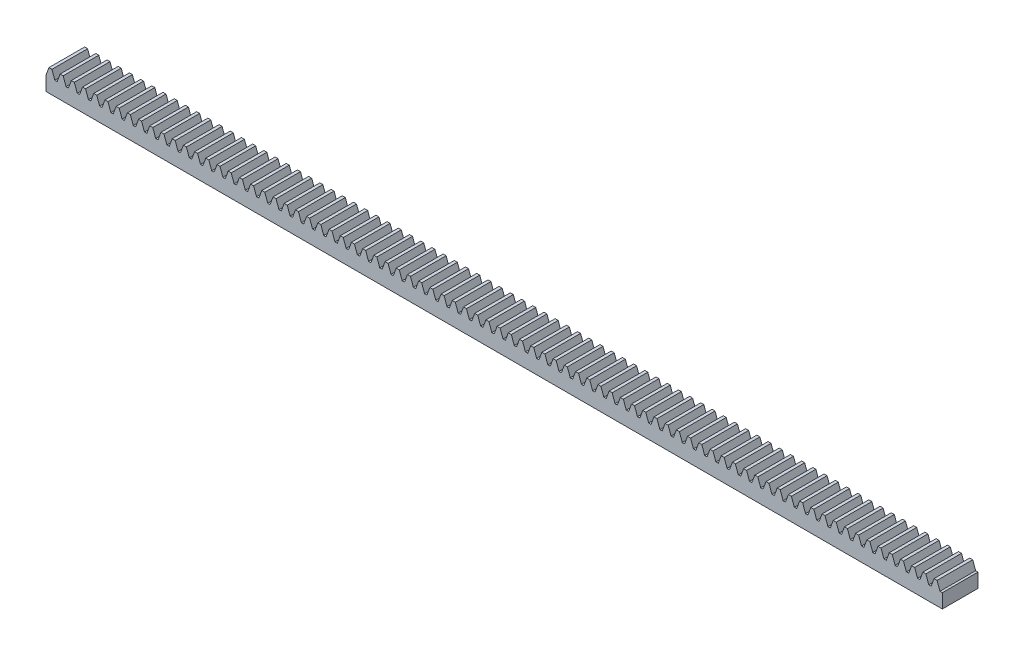
from build123d import *

# Parameters (mm, degrees)
SKETCH_1_W             = 502.654824574
SKETCH_1_H             = 7.95
EXTRUDE_1_DEPTH        = 20
EXTRUDE_2_DEPTH        = 20
PATTERN_LINEAR_1_COUNT = 80
PATTERN_LINEAR_1_PITCH = 6.283185307


with BuildPart() as part:
    # 草图1 → 拉伸1 (new body)
    with BuildSketch(Plane.XY):
        with Locations((251.327412287, -3.975)):
            Rectangle(SKETCH_1_W, SKETCH_1_H)
    extrude(amount=EXTRUDE_1_DEPTH)

    # 草图2 → 拉伸2 (add)
    with BuildSketch(Plane.XY.offset(20)):
        Polygon((0, 0), (1.637866054, 4.5), (3.323577771, 4.5), (4.961443825, 0), align=None)
    extrude_2 = extrude(amount=-EXTRUDE_2_DEPTH)

    # 阵列(线性)1: 拉伸2 ×80
    with Locations(*[(i * PATTERN_LINEAR_1_PITCH, 0, 0) for i in range(1, PATTERN_LINEAR_1_COUNT)]):
        add(extrude_2)


solid = part.part
